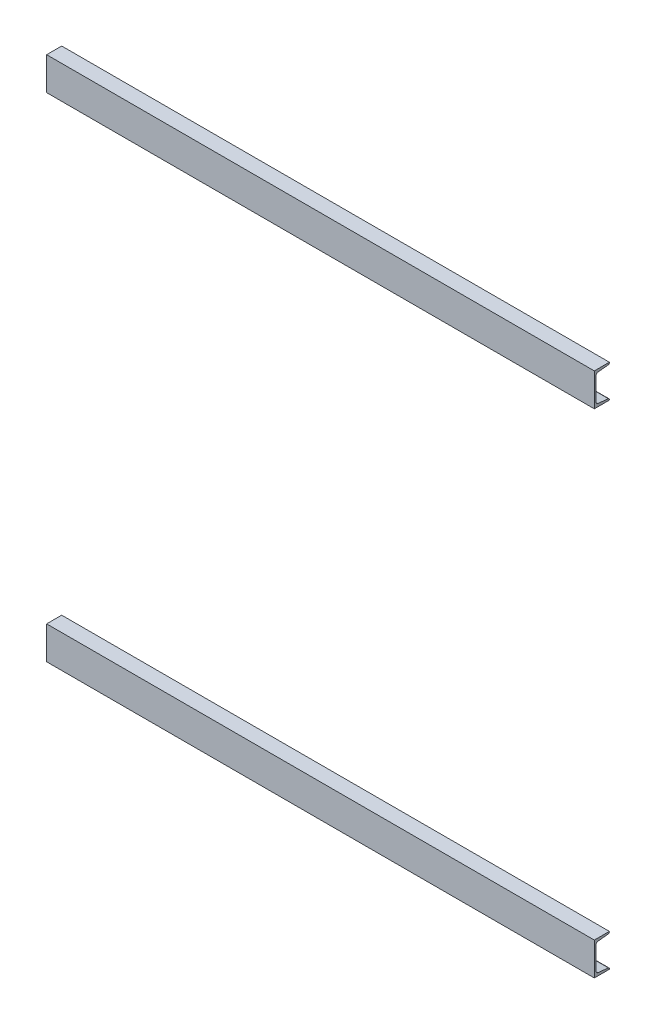
from build123d import *

# Parameters (mm, degrees)
MIEMBRO_ESTRUCTURAL1_DEPTH   = 2000
MIEMBRO_ESTRUCTURAL1_2_DEPTH = 2000


with BuildPart() as part:
    # Sketch1 → Miembro estructural1 (new body)
    with BuildSketch(Plane(origin=(-1000, 900, 0), x_dir=(0, 0, -1), z_dir=(-1, 0, 0))):
        with BuildLine():
            Line((55, 120), (0, 120))
            Line((0, 120), (0, 0))
            Line((0, 0), (55, 0))
            Line((55, 0), (55, 1.896373189))
            ThreePointArc((55, 1.896373189), (53.844151715, 4.907460917), (50.970378085, 6.371721718))
            Line((50.970378085, 6.371721718), (13.463772294, 10.313824837))
            ThreePointArc((13.463772294, 10.313824837), (8.354841396, 12.916955149), (6.3, 18.27))
            Line((6.3, 18.27), (6.3, 101.74))
            ThreePointArc((6.3, 101.74), (8.354841396, 107.093044851), (13.463772294, 109.696175163))
            Line((13.463772294, 109.696175163), (50.970378085, 113.638278282))
            ThreePointArc((50.970378085, 113.638278282), (53.844151715, 115.102539083), (55, 118.113626811))
            Line((55, 118.113626811), (55, 120))
        make_face()
    extrude(amount=-MIEMBRO_ESTRUCTURAL1_DEPTH)


with BuildPart() as body_2:
    # Sketch1 on segment 2 (carried to segment 2) → Miembro estructural1 2 (new body)
    with BuildSketch(Plane(origin=(1000, -900, 0), x_dir=(0, 0, -1), z_dir=(-1, 0, 0))):
        with BuildLine():
            Line((55, 120), (0, 120))
            Line((0, 120), (0, 0))
            Line((0, 0), (55, 0))
            Line((55, 0), (55, 1.896373189))
            ThreePointArc((55, 1.896373189), (53.844151715, 4.907460917), (50.970378085, 6.371721718))
            Line((50.970378085, 6.371721718), (13.463772294, 10.313824837))
            ThreePointArc((13.463772294, 10.313824837), (8.354841396, 12.916955149), (6.3, 18.27))
            Line((6.3, 18.27), (6.3, 101.74))
            ThreePointArc((6.3, 101.74), (8.354841396, 107.093044851), (13.463772294, 109.696175163))
            Line((13.463772294, 109.696175163), (50.970378085, 113.638278282))
            ThreePointArc((50.970378085, 113.638278282), (53.844151715, 115.102539083), (55, 118.113626811))
            Line((55, 118.113626811), (55, 120))
        make_face()
    extrude(amount=MIEMBRO_ESTRUCTURAL1_2_DEPTH)


solid = Compound([part.part, body_2.part])
